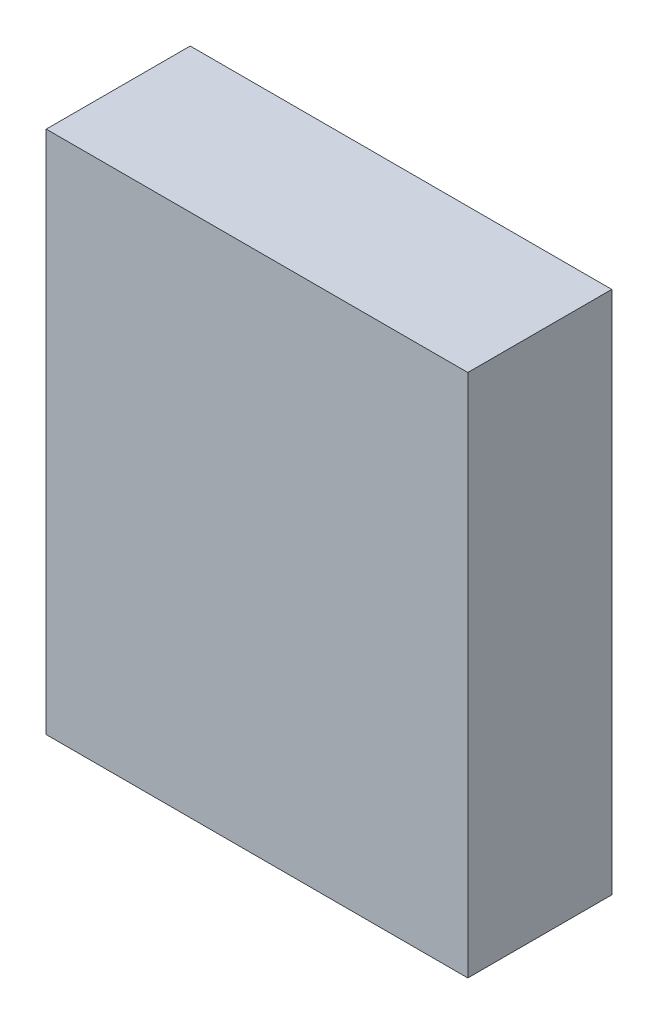
from build123d import *

# Parameters (mm, degrees)
SKETCH1_W           = 410
SKETCH1_H           = 510
BOSS_EXTRUDE1_DEPTH = 140


with BuildPart() as part:
    # Sketch1 → Boss-Extrude1 (new body)
    with BuildSketch(Plane.XY):
        Rectangle(SKETCH1_W, SKETCH1_H)
    extrude(amount=BOSS_EXTRUDE1_DEPTH)


solid = part.part
